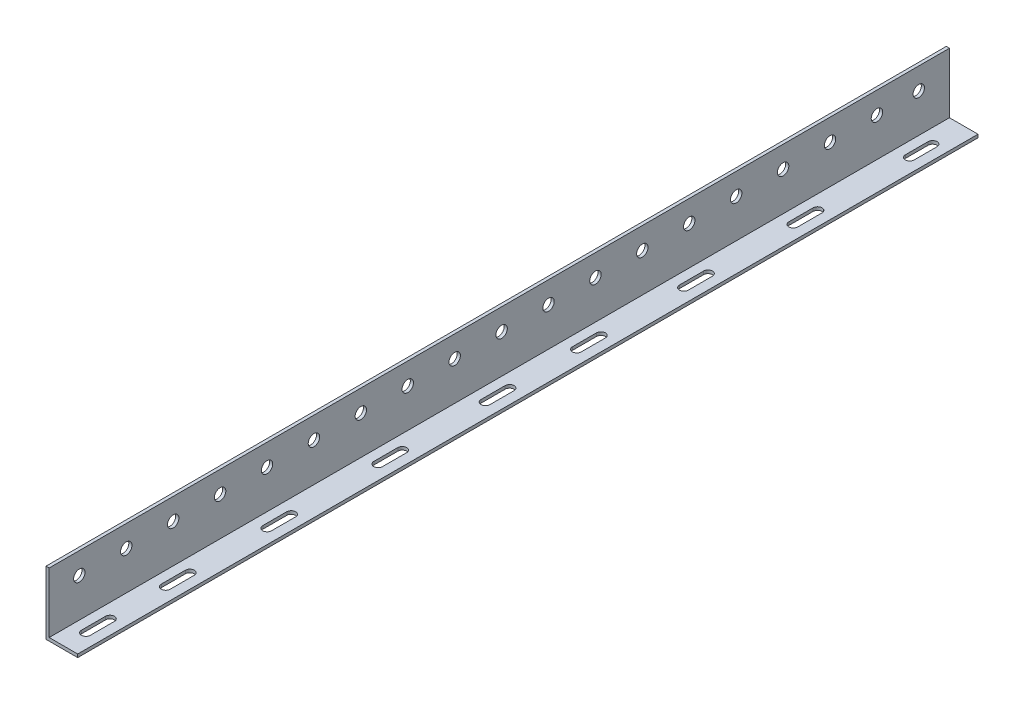
from build123d import *

# Parameters (mm, degrees)
BOSS_EXTRUDE1_DEPTH = 710
SKETCH2_R           = 4.5
CUT_EXTRUDE1_DEPTH  = 10
CUT_EXTRUDE2_DEPTH  = 10


with BuildPart() as part:
    # Sketch1 → Boss-Extrude1 (new body)
    with BuildSketch(Plane.XY):
        Polygon((-9.285714286, 23.80952381), (-9.285714286, -26.19047619), (15.714285714, -26.19047619), (15.714285714, -23.69047619), (-6.785714286, -23.69047619), (-6.785714286, 23.80952381), align=None)
    extrude(amount=BOSS_EXTRUDE1_DEPTH)

    # Sketch2 → Cut-Extrude1 (cut)
    with BuildSketch(Plane(origin=(-6.785714286, 0, 0), x_dir=(0, 0, -1), z_dir=(1, 0, 0))):
        with Locations(Location((-649.198051525, 6.719410966, 0), (0, 0, 90))):
            Circle(SKETCH2_R)
        with Locations(Location((-612.198051525, 6.716309021, 0), (0, 0, 90))):
            Circle(SKETCH2_R)
        with Locations(Location((-575.198051525, 6.713207076, 0), (0, 0, 90))):
            Circle(SKETCH2_R)
        with Locations(Location((-242.198051785, 6.685289571, 0), (0, 0, 90))):
            Circle(SKETCH2_R)
        with Locations(Location((-279.198051785, 6.688391516, 0), (0, 0, 90))):
            Circle(SKETCH2_R)
        with Locations(Location((-538.198051525, 6.710105131, 0), (0, 0, 90))):
            Circle(SKETCH2_R)
        with Locations(Location((-501.198051525, 6.707003186, 0), (0, 0, 90))):
            Circle(SKETCH2_R)
        with Locations(Location((-464.198051525, 6.703901241, 0), (0, 0, 90))):
            Circle(SKETCH2_R)
        with Locations(Location((-427.198051525, 6.700799296, 0), (0, 0, 90))):
            Circle(SKETCH2_R)
        with Locations(Location((-390.198051525, 6.697697351, 0), (0, 0, 90))):
            Circle(SKETCH2_R)
        with Locations(Location((-353.198051655, 6.694595406, 0), (0, 0, 90))):
            Circle(SKETCH2_R)
        with Locations(Location((-316.198051785, 6.691493461, 0), (0, 0, 90))):
            Circle(SKETCH2_R)
        with Locations(Location((-686.198051395, 6.722512911, 0), (0, 0, 90))):
            Circle(SKETCH2_R)
        with Locations(Location((-24.198051395, 6.667013246, 0), (0, 0, 90))):
            Circle(SKETCH2_R)
        with Locations(Location((-57.198052435, 6.669779846, 0), (0, 0, 90))):
            Circle(SKETCH2_R)
        with Locations(Location((-205.198051915, 6.682187626, 0), (0, 0, 90))):
            Circle(SKETCH2_R)
        with Locations(Location((-168.198052045, 6.679085681, 0), (0, 0, 90))):
            Circle(SKETCH2_R)
        with Locations(Location((-131.198052175, 6.675983736, 0), (0, 0, 90))):
            Circle(SKETCH2_R)
        with Locations(Location((-94.198052305, 6.672881791, 0), (0, 0, 90))):
            Circle(SKETCH2_R)
    extrude(amount=-CUT_EXTRUDE1_DEPTH, mode=Mode.SUBTRACT)

    # Sketch3 → Cut-Extrude2 (cut)
    with BuildSketch(Plane(origin=(0, -23.69047619, 0), x_dir=(1, 0, 0), z_dir=(0, 1, 0))):
        with BuildLine():
            Line((0.964285714, -220.615260366), (0.964285714, -201.615260366))
            ThreePointArc((0.964285714, -201.615260366), (4.464285714, -198.163676075), (7.964285714, -201.615260366))
            Line((7.964285714, -201.615260366), (7.964285714, -220.615260366))
            ThreePointArc((7.964285714, -220.615260366), (4.464285714, -224.19719897), (0.964285714, -220.615260366))
        make_face()
        with BuildLine():
            Line((0.963115287, -134.265755564), (0.964027858, -115.265755586))
            ThreePointArc((0.964027858, -115.265755586), (4.465316374, -111.767044577), (7.964027383, -115.268333093))
            Line((7.964027383, -115.268333093), (7.965046039, -134.268333066))
            ThreePointArc((7.965046039, -134.268333066), (4.462738275, -137.913718588), (0.963115287, -134.265755564))
        make_face()
        with BuildLine():
            Line((1.116372812, -42.705779315), (1.116372812, -24.705779315))
            ThreePointArc((1.116372812, -24.705779315), (4.616372812, -21.205779315), (8.116372812, -24.705779315))
            Line((8.116372812, -24.705779315), (8.116372812, -42.705779315))
            ThreePointArc((8.116372812, -42.705779315), (4.616372812, -46.205779315), (1.116372812, -42.705779315))
        make_face()
        with BuildLine():
            Line((0.944319512, -305.018833037), (0.944319512, -286.018833037))
            ThreePointArc((0.944319512, -286.018833037), (4.444319512, -282.567248747), (7.944319512, -286.018833037))
            Line((7.944319512, -286.018833037), (7.944319512, -305.018833037))
            ThreePointArc((7.944319512, -305.018833037), (4.444319512, -308.600771642), (0.944319512, -305.018833037))
        make_face()
        with BuildLine():
            Line((0.942476542, -377.078536786), (0.942476542, -358.078536786))
            ThreePointArc((0.942476542, -358.078536786), (4.442476542, -354.626952496), (7.942476542, -358.078536786))
            Line((7.942476542, -358.078536786), (7.942476542, -377.078536786))
            ThreePointArc((7.942476542, -377.078536786), (4.442476542, -380.660475391), (0.942476542, -377.078536786))
        make_face()
        with BuildLine():
            Line((0.937060946, -461.70401329), (0.937060946, -442.70401329))
            ThreePointArc((0.937060946, -442.70401329), (4.437060946, -439.252429), (7.937060946, -442.70401329))
            Line((7.937060946, -442.70401329), (7.937060946, -461.70401329))
            ThreePointArc((7.937060946, -461.70401329), (4.437060946, -465.285951895), (0.937060946, -461.70401329))
        make_face()
        with BuildLine():
            Line((0.982865657, -549.330591868), (0.982865657, -530.330591868))
            ThreePointArc((0.982865657, -530.330591868), (4.482865657, -526.879007577), (7.982865657, -530.330591868))
            Line((7.982865657, -530.330591868), (7.982865657, -549.330591868))
            ThreePointArc((7.982865657, -549.330591868), (4.482865657, -552.912530473), (0.982865657, -549.330591868))
        make_face()
        with BuildLine():
            Line((0.930766494, -629.221929405), (0.930766494, -610.221929405))
            ThreePointArc((0.930766494, -610.221929405), (4.430766494, -606.770345115), (7.930766494, -610.221929405))
            Line((7.930766494, -610.221929405), (7.930766494, -629.221929405))
            ThreePointArc((7.930766494, -629.221929405), (4.430766494, -632.80386801), (0.930766494, -629.221929405))
        make_face()
        with BuildLine():
            Line((0.92534668, -692.195222709), (0.92534668, -673.195222709))
            ThreePointArc((0.92534668, -673.195222709), (4.42534668, -669.743638419), (7.92534668, -673.195222709))
            Line((7.92534668, -673.195222709), (7.92534668, -692.195222709))
            ThreePointArc((7.92534668, -692.195222709), (4.42534668, -695.777161314), (0.92534668, -692.195222709))
        make_face()
    extrude(amount=-CUT_EXTRUDE2_DEPTH, mode=Mode.SUBTRACT)


solid = part.part
